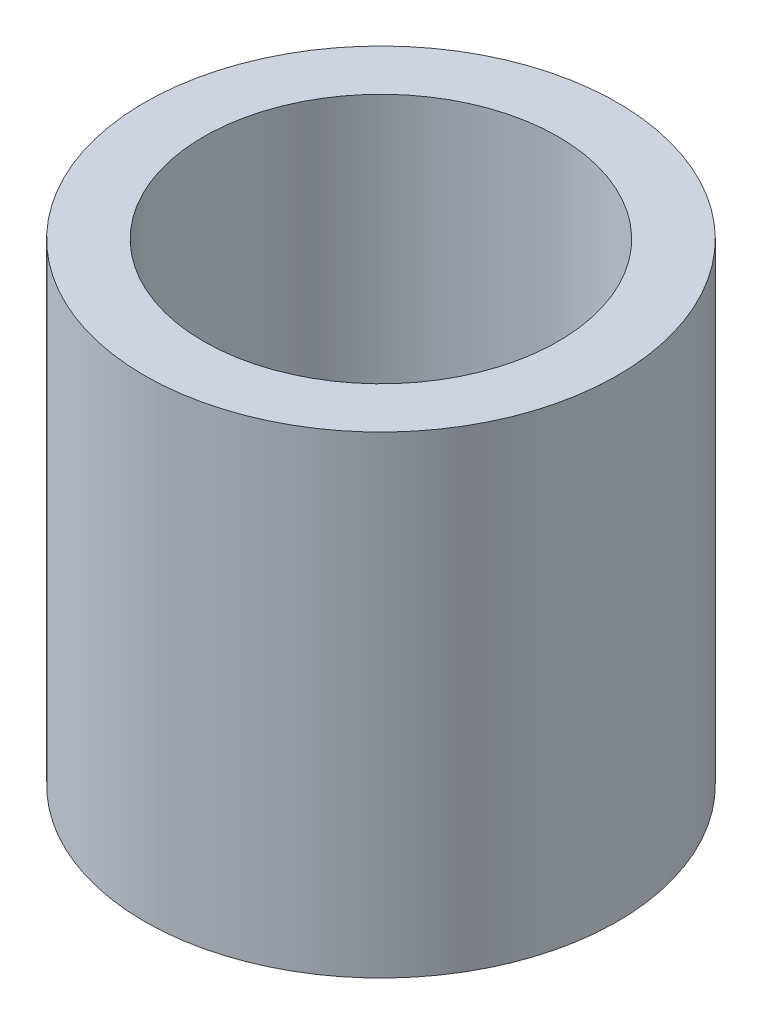
from build123d import *

# Parameters (mm, degrees)
SKETCH1_R           = 12.7
BOSS_EXTRUDE1_DEPTH = 25.4
SKETCH2_R           = 9.525
CUT_EXTRUDE1_DEPTH  = 22.225
SKETCH3_R           = 2.54
CUT_EXTRUDE2_DEPTH  = 29.575


with BuildPart() as part:
    # Sketch1 → Boss-Extrude1 (new body)
    with BuildSketch(Plane(origin=(0, 0, 0), x_dir=(1, 0, 0), z_dir=(0, 1, 0))):
        with Locations(Location((0, 0, 0), (0, 0, 270))):
            Circle(SKETCH1_R)
    extrude(amount=BOSS_EXTRUDE1_DEPTH)

    # Sketch2 → Cut-Extrude1 (cut)
    with BuildSketch(Plane(origin=(0, 25.4, 0), x_dir=(1, 0, 0), z_dir=(0, 1, 0))):
        with Locations(Location((0, 0, 0), (0, 0, 270))):
            Circle(SKETCH2_R)
    extrude(amount=-CUT_EXTRUDE1_DEPTH, mode=Mode.SUBTRACT)

    # Sketch3 → Cut-Extrude2 (cut, through all)
    with BuildSketch(Plane(origin=(0, 3.175, 0), x_dir=(1, 0, 0), z_dir=(0, 1, 0))):
        with Locations(Location((0, 0, 0), (0, 0, 270))):
            Circle(SKETCH3_R)
    extrude(amount=-CUT_EXTRUDE2_DEPTH, mode=Mode.SUBTRACT)


solid = part.part
